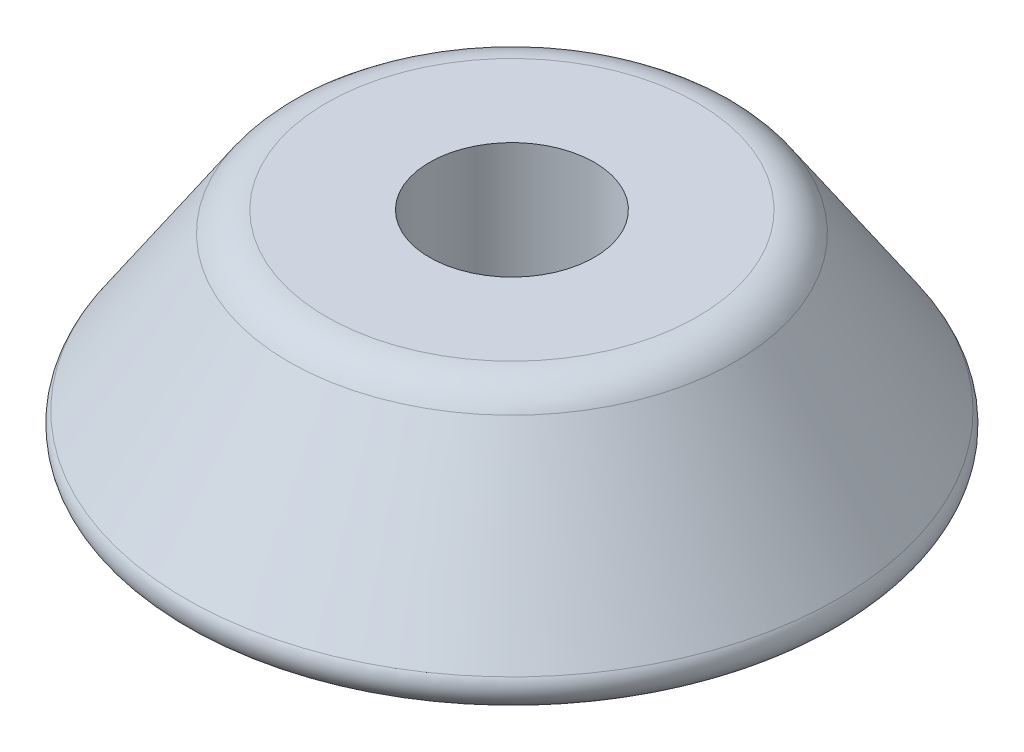
from build123d import *


with BuildPart() as part:
    # Sketch1 → Revolve1 (revolve)
    with BuildSketch(Plane.XY, mode=Mode.PRIVATE) as revolve1_sk:
        with BuildLine():
            Line((4, 0), (4, 10))
            Line((4, 10), (9, 10))
            ThreePointArc((9, 10), (10.037666615, 9.740367053), (10.830793065, 9.022654224))
            Line((10.830793065, 9.022654224), (15.830886714, 1.556441612))
            ThreePointArc((15.830886714, 1.556441612), (15.882168241, 0.529065616), (15, 0))
            Line((15, 0), (4, 0))
        make_face()
    revolve(revolve1_sk.sketch.rotate(Axis((0, 0, 0), (0, 1, 0)), 90), axis=Axis((0, 0, 0), (0, 1, 0)))


solid = part.part
